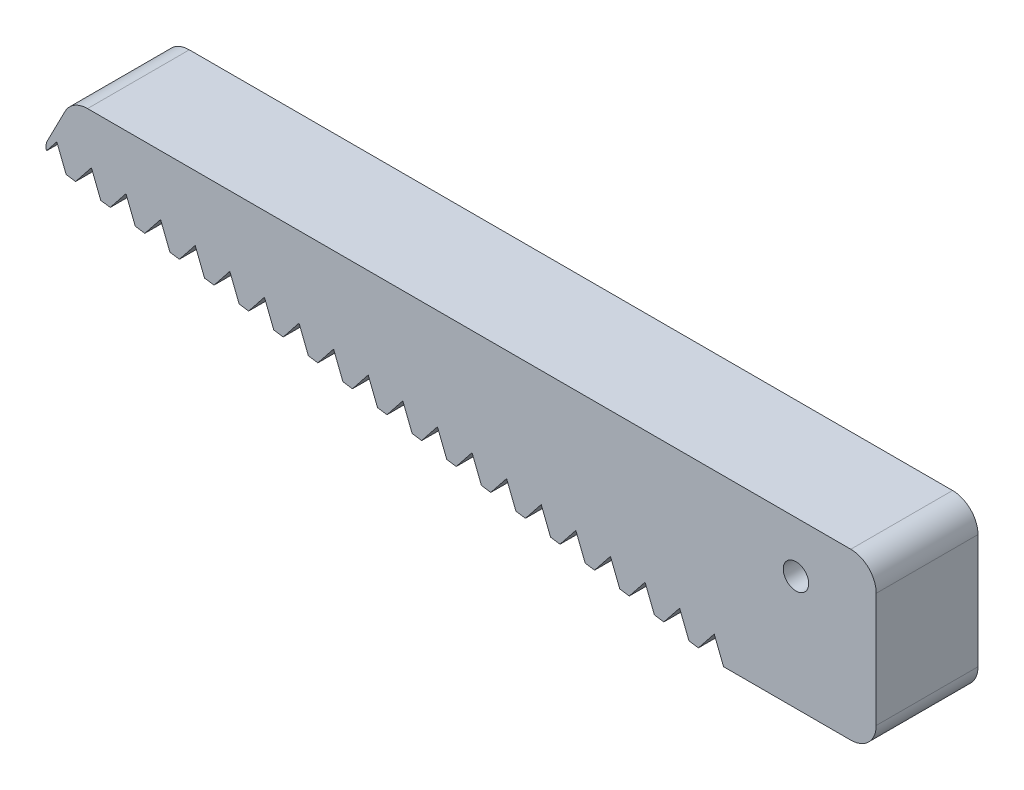
from build123d import *

# Parameters (mm, degrees)
SKETCH1_R           = 1
BOSS_EXTRUDE1_DEPTH = 8
CUT_EXTRUDE1_START  = -10
CUT_EXTRUDE1_DEPTH  = 10


with BuildPart() as part:
    # Sketch1 → Boss-Extrude1 (new body)
    with BuildSketch(Plane.XY):
        with BuildLine():
            Line((-4.413883096, 7.780619908), (48, 0))
            Line((48, 0), (58, 0))
            ThreePointArc((58, 0), (59.414213562, 0.585786438), (60, 2))
            Line((60, 2), (60, 11))
            ThreePointArc((60, 11), (59.414213562, 12.414213562), (58, 13))
            Line((58, 13), (-2, 13))
            ThreePointArc((-2, 13), (-3.042889965, 12.706569811), (-3.779764531, 11.912380521))
            Line((-3.779764531, 11.912380521), (-5.156928621, 9.22597091))
            ThreePointArc((-5.156928621, 9.22597091), (-5.156403682, 8.312567847), (-4.413883096, 7.780619908))
        make_face()
        with Locations((53.689231255, 9)):
            Circle(SKETCH1_R, mode=Mode.SUBTRACT)
    extrude(amount=BOSS_EXTRUDE1_DEPTH)

    # Sketch2 → Cut-Extrude1 (cut)
    with BuildSketch(Plane.XY.offset(8).offset(CUT_EXTRUDE1_START)):
        Polygon((-2.939974596, 7.561824407), (-0.965260048, 7.26868636), (-1.698752327, 9.125408347), align=None)
        with BuildLine():
            Line((-4.413883096, 7.780619908), (-3.685452086, 7.672487397))
            Line((-3.685452086, 7.672487397), (-4.418944365, 9.529209384))
            Line((-4.418944365, 9.529209384), (-5.231519115, 8.505598334))
            ThreePointArc((-5.231519115, 8.505598334), (-4.930484846, 8.021549823), (-4.413883096, 7.780619908))
        make_face()
        Polygon((-0.219982955, 7.158053119), (1.755132364, 6.864855579), (1.021491222, 8.72195439), align=None)
        Polygon((2.500209083, 6.754252082), (4.475324402, 6.461054542), (3.74168326, 8.318153353), align=None)
        Polygon((5.220200725, 6.350480793), (7.195716813, 6.057223761), (6.461926809, 7.914699396), align=None)
        Polygon((7.940392763, 5.946679757), (9.915908851, 5.653422725), (9.182118847, 7.510898359), align=None)
        Polygon((10.660384404, 5.542908468), (12.636301263, 5.249591943), (11.902362396, 7.107444402), align=None)
        Polygon((13.380576442, 5.139107432), (15.356493301, 4.845790907), (14.622554434, 6.703643365), align=None)
        Polygon((16.100568083, 4.735336143), (18.076885713, 4.441960126), (17.342797982, 6.300189408), align=None)
        Polygon((18.820760121, 4.331535107), (20.797077751, 4.038159089), (20.06299002, 5.896388371), align=None)
        Polygon((21.540751763, 3.927763818), (23.517470163, 3.634328308), (22.783233569, 5.492934414), align=None)
        Polygon((24.260943801, 3.523962782), (26.237662201, 3.230527271), (25.503425607, 5.089133377), align=None)
        Polygon((26.980935442, 3.120191493), (28.958054613, 2.82669649), (28.223669156, 4.68567942), align=None)
        Polygon((29.70112748, 2.716390456), (31.678246651, 2.422895453), (30.943861194, 4.281878383), align=None)
        Polygon((46.021678518, 0.293673481), (48, 0), (47.265167954, 1.860113401), align=None)
        Polygon((43.30148648, 0.697474518), (45.279807962, 0.403801037), (44.544975916, 2.263914437), align=None)
        Polygon((40.581494839, 1.101245806), (42.55941555, 0.807631818), (41.824732367, 2.667368395), align=None)
        Polygon((37.861302801, 1.505046843), (39.839223512, 1.211432854), (39.104540329, 3.071169432), align=None)
        Polygon((35.141311159, 1.908818131), (37.1188311, 1.615263636), (36.384296781, 3.474623389), align=None)
        Polygon((32.421119121, 2.312619168), (34.398639063, 2.019064672), (33.664104743, 3.878424426), align=None)
    extrude(amount=CUT_EXTRUDE1_DEPTH, mode=Mode.SUBTRACT)


solid = part.part
